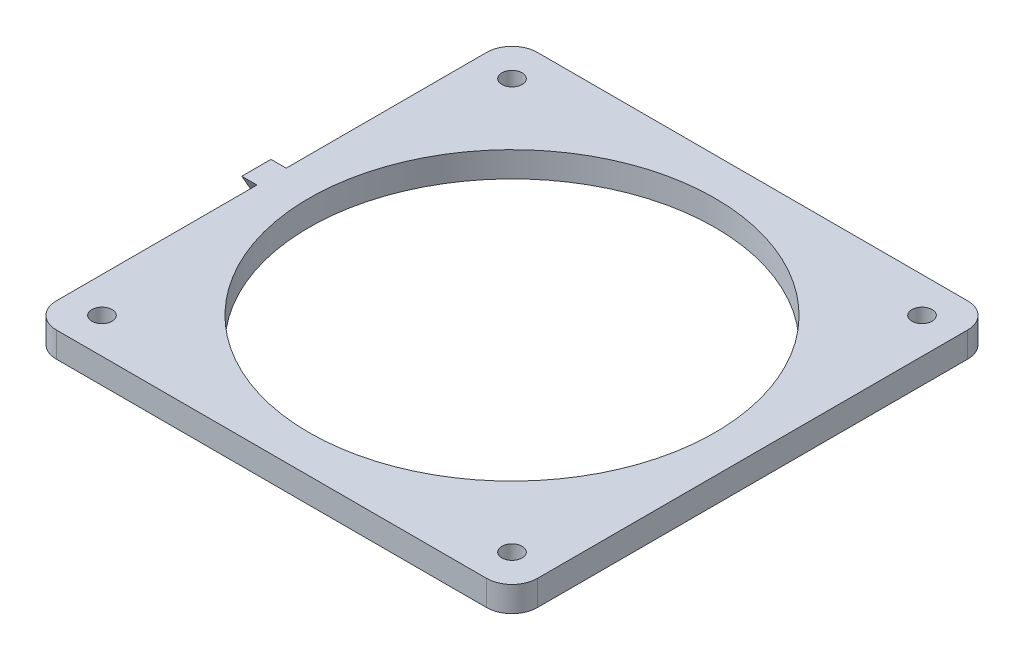
from build123d import *

# Parameters (mm, degrees)
SKETCH1_W             = 95
SKETCH1_H             = 95
SKETCH1_W_2           = 81
SKETCH1_H_2           = 81
SKETCH1_R             = 40.1
BOSS_EXTRUDE1_DEPTH   = 5
F_4_0MM_DOWEL_HOLE1_D = 4
BOSS_EXTRUDE2_DEPTH   = 3
FILLET1_R             = 5


with BuildPart() as part:
    # Sketch1 → Boss-Extrude1 (new body)
    # profile 1 of 2: a face of its own
    with BuildSketch(Plane(origin=(0, 0, 0), x_dir=(1, 0, 0), z_dir=(0, 1, 0))):
        Rectangle(SKETCH1_W, SKETCH1_H)
        Rectangle(SKETCH1_W_2, SKETCH1_H_2, mode=Mode.SUBTRACT)
    # profile 2 of 2: a face of its own
    with BuildSketch(Plane(origin=(0, 0, 0), x_dir=(1, 0, 0), z_dir=(0, 1, 0))):
        Rectangle(SKETCH1_W_2, SKETCH1_H_2)
        with Locations(Location((0, 0, 0), (0, 0, 270))):
            Circle(SKETCH1_R, mode=Mode.SUBTRACT)
    extrude(amount=BOSS_EXTRUDE1_DEPTH)

    # Ø4.0mm Dowel Hole1 (through all)
    with Locations(Plane(origin=(0, 0, 0), x_dir=(-1, 0, 0), z_dir=(0, -1, 0))):
        with Locations((40.5, -40.5), (-40.5, -40.5), (-40.5, 40.5), (40.5, 40.5)):
            Hole(F_4_0MM_DOWEL_HOLE1_D / 2)

    # Sketch5 → Boss-Extrude2 (add)
    with BuildSketch(Plane.ZY.offset(47.5)):
        Polygon((0, 0), (-2.886751346, 5), (2.886751346, 5), align=None)
    extrude(amount=BOSS_EXTRUDE2_DEPTH)

    # Fillet1
    fillet1_edges = [part.edges().sort_by_distance(p)[0] for p in [
        (-47.5, 2.5, 47.5),
        (-47.5, 2.5, -47.5),
        (47.5, 2.5, -47.5),
        (47.5, 2.5, 47.5),
    ]]
    fillet(fillet1_edges, radius=FILLET1_R)


solid = part.part
